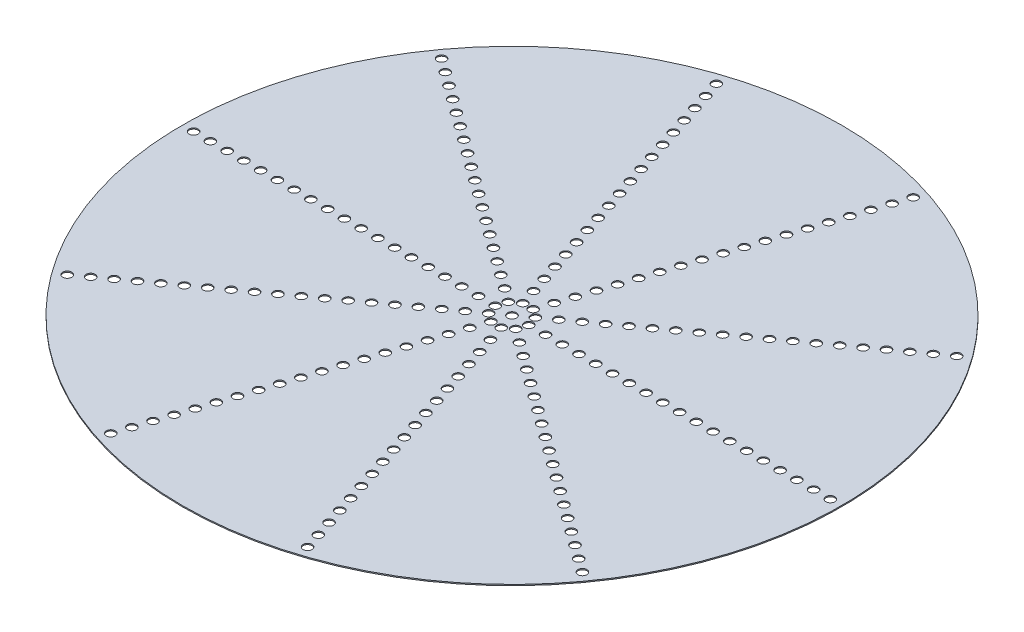
from build123d import *

# Parameters (mm, degrees)
CROQUIS1_R              = 29.5
SALIENTE_EXTRUIR1_DEPTH = 0.1
CROQUIS3_R              = 0.4
CORTAR_EXTRUIR3_DEPTH   = 42.719419938


with BuildPart() as part:
    # Croquis1 → Saliente-Extruir1 (new body)
    with BuildSketch(Plane(origin=(0, 0, 0), x_dir=(1, 0, 0), z_dir=(0, 1, 0))):
        with Locations(Location((0, 0, 0), (0, 0, 270))):
            Circle(CROQUIS1_R)
    extrude(amount=SALIENTE_EXTRUIR1_DEPTH)

    # Croquis3 → Cortar-Extruir3 (cut, through all)
    with BuildSketch(Plane(origin=(0, 0.1, 0), x_dir=(1, 0, 0), z_dir=(0, 1, 0))):
        with Locations(Location((0, 0, 0), (0, 0, 270))):
            Circle(CROQUIS3_R)
        with Locations(Location((1.5, 0, 0), (0, 0, 270))):
            Circle(CROQUIS3_R)
        with Locations(Location((3, 0, 0), (0, 0, 270))):
            Circle(CROQUIS3_R)
        with Locations(Location((4.5, 0, 0), (0, 0, 270))):
            Circle(CROQUIS3_R)
        with Locations(Location((6, 0, 0), (0, 0, 270))):
            Circle(CROQUIS3_R)
        with Locations(Location((7.5, 0, 0), (0, 0, 270))):
            Circle(CROQUIS3_R)
        with Locations(Location((9, 0, 0), (0, 0, 270))):
            Circle(CROQUIS3_R)
        with Locations(Location((10.5, 0, 0), (0, 0, 270))):
            Circle(CROQUIS3_R)
        with Locations(Location((12, 0, 0), (0, 0, 270))):
            Circle(CROQUIS3_R)
        with Locations(Location((13.5, 0, 0), (0, 0, 270))):
            Circle(CROQUIS3_R)
        with Locations(Location((15, 0, 0), (0, 0, 270))):
            Circle(CROQUIS3_R)
        with Locations(Location((16.5, 0, 0), (0, 0, 270))):
            Circle(CROQUIS3_R)
        with Locations(Location((18, 0, 0), (0, 0, 270))):
            Circle(CROQUIS3_R)
        with Locations(Location((19.5, 0, 0), (0, 0, 270))):
            Circle(CROQUIS3_R)
        with Locations(Location((21, 0, 0), (0, 0, 270))):
            Circle(CROQUIS3_R)
        with Locations(Location((22.5, 0, 0), (0, 0, 270))):
            Circle(CROQUIS3_R)
        with Locations(Location((24, 0, 0), (0, 0, 270))):
            Circle(CROQUIS3_R)
        with Locations(Location((25.5, 0, 0), (0, 0, 270))):
            Circle(CROQUIS3_R)
        with Locations(Location((27, 0, 0), (0, 0, 270))):
            Circle(CROQUIS3_R)
        with Locations(Location((28.5, 0, 0), (0, 0, 270))):
            Circle(CROQUIS3_R)
        with Locations(Location((14.562305899, -10.580134541, 0), (0, 0, 270))):
            Circle(CROQUIS3_R)
        with Locations(Location((13.348780407, -9.698456663, 0), (0, 0, 270))):
            Circle(CROQUIS3_R)
        with Locations(Location((12.135254916, -8.816778784, 0), (0, 0, 270))):
            Circle(CROQUIS3_R)
        with Locations(Location((10.921729424, -7.935100906, 0), (0, 0, 270))):
            Circle(CROQUIS3_R)
        with Locations(Location((9.708203932, -7.053423028, 0), (0, 0, 270))):
            Circle(CROQUIS3_R)
        with Locations(Location((8.494678441, -6.171745149, 0), (0, 0, 270))):
            Circle(CROQUIS3_R)
        with Locations(Location((7.281152949, -5.290067271, 0), (0, 0, 270))):
            Circle(CROQUIS3_R)
        with Locations(Location((6.067627458, -4.408389392, 0), (0, 0, 270))):
            Circle(CROQUIS3_R)
        with Locations(Location((4.854101966, -3.526711514, 0), (0, 0, 270))):
            Circle(CROQUIS3_R)
        with Locations(Location((2.427050983, -1.763355757, 0), (0, 0, 270))):
            Circle(CROQUIS3_R)
        with Locations(Location((1.213525492, -0.881677878, 0), (0, 0, 270))):
            Circle(CROQUIS3_R)
        with Locations(Location((3.640576475, -2.645033635, 0), (0, 0, 270))):
            Circle(CROQUIS3_R)
        with Locations(Location((15.77583139, -11.46181242, 0), (0, 0, 270))):
            Circle(CROQUIS3_R)
        with Locations(Location((16.989356882, -12.343490298, 0), (0, 0, 270))):
            Circle(CROQUIS3_R)
        with Locations(Location((18.202882373, -13.225168177, 0), (0, 0, 270))):
            Circle(CROQUIS3_R)
        with Locations(Location((19.416407865, -14.106846055, 0), (0, 0, 270))):
            Circle(CROQUIS3_R)
        with Locations(Location((20.629933357, -14.988523933, 0), (0, 0, 270))):
            Circle(CROQUIS3_R)
        with Locations(Location((21.843458848, -15.870201812, 0), (0, 0, 270))):
            Circle(CROQUIS3_R)
        with Locations(Location((23.05698434, -16.75187969, 0), (0, 0, 270))):
            Circle(CROQUIS3_R)
        with Locations(Location((5.562305899, -17.119017293, 0), (0, 0, 270))):
            Circle(CROQUIS3_R)
        with Locations(Location((5.098780407, -15.692432519, 0), (0, 0, 270))):
            Circle(CROQUIS3_R)
        with Locations(Location((4.635254916, -14.265847744, 0), (0, 0, 270))):
            Circle(CROQUIS3_R)
        with Locations(Location((4.171729424, -12.83926297, 0), (0, 0, 270))):
            Circle(CROQUIS3_R)
        with Locations(Location((3.708203932, -11.412678196, 0), (0, 0, 270))):
            Circle(CROQUIS3_R)
        with Locations(Location((3.244678441, -9.986093421, 0), (0, 0, 270))):
            Circle(CROQUIS3_R)
        with Locations(Location((2.781152949, -8.559508647, 0), (0, 0, 270))):
            Circle(CROQUIS3_R)
        with Locations(Location((2.317627458, -7.132923872, 0), (0, 0, 270))):
            Circle(CROQUIS3_R)
        with Locations(Location((1.854101966, -5.706339098, 0), (0, 0, 270))):
            Circle(CROQUIS3_R)
        with Locations(Location((0.927050983, -2.853169549, 0), (0, 0, 270))):
            Circle(CROQUIS3_R)
        with Locations(Location((0.463525492, -1.426584774, 0), (0, 0, 270))):
            Circle(CROQUIS3_R)
        with Locations(Location((1.390576475, -4.279754323, 0), (0, 0, 270))):
            Circle(CROQUIS3_R)
        with Locations(Location((6.02583139, -18.545602068, 0), (0, 0, 270))):
            Circle(CROQUIS3_R)
        with Locations(Location((6.489356882, -19.972186842, 0), (0, 0, 270))):
            Circle(CROQUIS3_R)
        with Locations(Location((6.952882373, -21.398771617, 0), (0, 0, 270))):
            Circle(CROQUIS3_R)
        with Locations(Location((7.416407865, -22.825356391, 0), (0, 0, 270))):
            Circle(CROQUIS3_R)
        with Locations(Location((7.879933357, -24.251941166, 0), (0, 0, 270))):
            Circle(CROQUIS3_R)
        with Locations(Location((8.343458848, -25.67852594, 0), (0, 0, 270))):
            Circle(CROQUIS3_R)
        with Locations(Location((8.80698434, -27.105110714, 0), (0, 0, 270))):
            Circle(CROQUIS3_R)
        with Locations(Location((-5.562305899, -17.119017293, 0), (0, 0, 270))):
            Circle(CROQUIS3_R)
        with Locations(Location((-5.098780407, -15.692432519, 0), (0, 0, 270))):
            Circle(CROQUIS3_R)
        with Locations(Location((-4.635254916, -14.265847744, 0), (0, 0, 270))):
            Circle(CROQUIS3_R)
        with Locations(Location((-4.171729424, -12.83926297, 0), (0, 0, 270))):
            Circle(CROQUIS3_R)
        with Locations(Location((-3.708203932, -11.412678196, 0), (0, 0, 270))):
            Circle(CROQUIS3_R)
        with Locations(Location((-3.244678441, -9.986093421, 0), (0, 0, 270))):
            Circle(CROQUIS3_R)
        with Locations(Location((-2.781152949, -8.559508647, 0), (0, 0, 270))):
            Circle(CROQUIS3_R)
        with Locations(Location((-2.317627458, -7.132923872, 0), (0, 0, 270))):
            Circle(CROQUIS3_R)
        with Locations(Location((-1.854101966, -5.706339098, 0), (0, 0, 270))):
            Circle(CROQUIS3_R)
        with Locations(Location((-0.927050983, -2.853169549, 0), (0, 0, 270))):
            Circle(CROQUIS3_R)
        with Locations(Location((-0.463525492, -1.426584774, 0), (0, 0, 270))):
            Circle(CROQUIS3_R)
        with Locations(Location((-1.390576475, -4.279754323, 0), (0, 0, 270))):
            Circle(CROQUIS3_R)
        with Locations(Location((-6.02583139, -18.545602068, 0), (0, 0, 270))):
            Circle(CROQUIS3_R)
        with Locations(Location((-6.489356882, -19.972186842, 0), (0, 0, 270))):
            Circle(CROQUIS3_R)
        with Locations(Location((-6.952882373, -21.398771617, 0), (0, 0, 270))):
            Circle(CROQUIS3_R)
        with Locations(Location((-7.416407865, -22.825356391, 0), (0, 0, 270))):
            Circle(CROQUIS3_R)
        with Locations(Location((-7.879933357, -24.251941166, 0), (0, 0, 270))):
            Circle(CROQUIS3_R)
        with Locations(Location((-8.343458848, -25.67852594, 0), (0, 0, 270))):
            Circle(CROQUIS3_R)
        with Locations(Location((-8.80698434, -27.105110714, 0), (0, 0, 270))):
            Circle(CROQUIS3_R)
        with Locations(Location((-14.562305899, -10.580134541, 0), (0, 0, 270))):
            Circle(CROQUIS3_R)
        with Locations(Location((-13.348780407, -9.698456663, 0), (0, 0, 270))):
            Circle(CROQUIS3_R)
        with Locations(Location((-12.135254916, -8.816778784, 0), (0, 0, 270))):
            Circle(CROQUIS3_R)
        with Locations(Location((-10.921729424, -7.935100906, 0), (0, 0, 270))):
            Circle(CROQUIS3_R)
        with Locations(Location((-9.708203932, -7.053423028, 0), (0, 0, 270))):
            Circle(CROQUIS3_R)
        with Locations(Location((-8.494678441, -6.171745149, 0), (0, 0, 270))):
            Circle(CROQUIS3_R)
        with Locations(Location((-7.281152949, -5.290067271, 0), (0, 0, 270))):
            Circle(CROQUIS3_R)
        with Locations(Location((-6.067627458, -4.408389392, 0), (0, 0, 270))):
            Circle(CROQUIS3_R)
        with Locations(Location((-4.854101966, -3.526711514, 0), (0, 0, 270))):
            Circle(CROQUIS3_R)
        with Locations(Location((-2.427050983, -1.763355757, 0), (0, 0, 270))):
            Circle(CROQUIS3_R)
        with Locations(Location((-1.213525492, -0.881677878, 0), (0, 0, 270))):
            Circle(CROQUIS3_R)
        with Locations(Location((-3.640576475, -2.645033635, 0), (0, 0, 270))):
            Circle(CROQUIS3_R)
        with Locations(Location((-15.77583139, -11.46181242, 0), (0, 0, 270))):
            Circle(CROQUIS3_R)
        with Locations(Location((-16.989356882, -12.343490298, 0), (0, 0, 270))):
            Circle(CROQUIS3_R)
        with Locations(Location((-18.202882373, -13.225168177, 0), (0, 0, 270))):
            Circle(CROQUIS3_R)
        with Locations(Location((-19.416407865, -14.106846055, 0), (0, 0, 270))):
            Circle(CROQUIS3_R)
        with Locations(Location((-20.629933357, -14.988523933, 0), (0, 0, 270))):
            Circle(CROQUIS3_R)
        with Locations(Location((-21.843458848, -15.870201812, 0), (0, 0, 270))):
            Circle(CROQUIS3_R)
        with Locations(Location((-23.05698434, -16.75187969, 0), (0, 0, 270))):
            Circle(CROQUIS3_R)
        with Locations(Location((-18, 0, 0), (0, 0, 270))):
            Circle(CROQUIS3_R)
        with Locations(Location((-16.5, 0, 0), (0, 0, 270))):
            Circle(CROQUIS3_R)
        with Locations(Location((-15, 0, 0), (0, 0, 270))):
            Circle(CROQUIS3_R)
        with Locations(Location((-13.5, 0, 0), (0, 0, 270))):
            Circle(CROQUIS3_R)
        with Locations(Location((-12, 0, 0), (0, 0, 270))):
            Circle(CROQUIS3_R)
        with Locations(Location((-10.5, 0, 0), (0, 0, 270))):
            Circle(CROQUIS3_R)
        with Locations(Location((-9, 0, 0), (0, 0, 270))):
            Circle(CROQUIS3_R)
        with Locations(Location((-7.5, 0, 0), (0, 0, 270))):
            Circle(CROQUIS3_R)
        with Locations(Location((-6, 0, 0), (0, 0, 270))):
            Circle(CROQUIS3_R)
        with Locations(Location((-3, 0, 0), (0, 0, 270))):
            Circle(CROQUIS3_R)
        with Locations(Location((-1.5, 0, 0), (0, 0, 270))):
            Circle(CROQUIS3_R)
        with Locations(Location((-4.5, 0, 0), (0, 0, 270))):
            Circle(CROQUIS3_R)
        with Locations(Location((-19.5, 0, 0), (0, 0, 270))):
            Circle(CROQUIS3_R)
        with Locations(Location((-21, 0, 0), (0, 0, 270))):
            Circle(CROQUIS3_R)
        with Locations(Location((-22.5, 0, 0), (0, 0, 270))):
            Circle(CROQUIS3_R)
        with Locations(Location((-24, 0, 0), (0, 0, 270))):
            Circle(CROQUIS3_R)
        with Locations(Location((-25.5, 0, 0), (0, 0, 270))):
            Circle(CROQUIS3_R)
        with Locations(Location((-27, 0, 0), (0, 0, 270))):
            Circle(CROQUIS3_R)
        with Locations(Location((-28.5, 0, 0), (0, 0, 270))):
            Circle(CROQUIS3_R)
        with Locations(Location((-14.562305899, 10.580134541, 0), (0, 0, 270))):
            Circle(CROQUIS3_R)
        with Locations(Location((-13.348780407, 9.698456663, 0), (0, 0, 270))):
            Circle(CROQUIS3_R)
        with Locations(Location((-12.135254916, 8.816778784, 0), (0, 0, 270))):
            Circle(CROQUIS3_R)
        with Locations(Location((-10.921729424, 7.935100906, 0), (0, 0, 270))):
            Circle(CROQUIS3_R)
        with Locations(Location((-9.708203932, 7.053423028, 0), (0, 0, 270))):
            Circle(CROQUIS3_R)
        with Locations(Location((-8.494678441, 6.171745149, 0), (0, 0, 270))):
            Circle(CROQUIS3_R)
        with Locations(Location((-7.281152949, 5.290067271, 0), (0, 0, 270))):
            Circle(CROQUIS3_R)
        with Locations(Location((-6.067627458, 4.408389392, 0), (0, 0, 270))):
            Circle(CROQUIS3_R)
        with Locations(Location((-4.854101966, 3.526711514, 0), (0, 0, 270))):
            Circle(CROQUIS3_R)
        with Locations(Location((-2.427050983, 1.763355757, 0), (0, 0, 270))):
            Circle(CROQUIS3_R)
        with Locations(Location((-1.213525492, 0.881677878, 0), (0, 0, 270))):
            Circle(CROQUIS3_R)
        with Locations(Location((-3.640576475, 2.645033635, 0), (0, 0, 270))):
            Circle(CROQUIS3_R)
        with Locations(Location((-15.77583139, 11.46181242, 0), (0, 0, 270))):
            Circle(CROQUIS3_R)
        with Locations(Location((-16.989356882, 12.343490298, 0), (0, 0, 270))):
            Circle(CROQUIS3_R)
        with Locations(Location((-18.202882373, 13.225168177, 0), (0, 0, 270))):
            Circle(CROQUIS3_R)
        with Locations(Location((-19.416407865, 14.106846055, 0), (0, 0, 270))):
            Circle(CROQUIS3_R)
        with Locations(Location((-20.629933357, 14.988523933, 0), (0, 0, 270))):
            Circle(CROQUIS3_R)
        with Locations(Location((-21.843458848, 15.870201812, 0), (0, 0, 270))):
            Circle(CROQUIS3_R)
        with Locations(Location((-23.05698434, 16.75187969, 0), (0, 0, 270))):
            Circle(CROQUIS3_R)
        with Locations(Location((-5.562305899, 17.119017293, 0), (0, 0, 270))):
            Circle(CROQUIS3_R)
        with Locations(Location((-5.098780407, 15.692432519, 0), (0, 0, 270))):
            Circle(CROQUIS3_R)
        with Locations(Location((-4.635254916, 14.265847744, 0), (0, 0, 270))):
            Circle(CROQUIS3_R)
        with Locations(Location((-4.171729424, 12.83926297, 0), (0, 0, 270))):
            Circle(CROQUIS3_R)
        with Locations(Location((-3.708203932, 11.412678196, 0), (0, 0, 270))):
            Circle(CROQUIS3_R)
        with Locations(Location((-3.244678441, 9.986093421, 0), (0, 0, 270))):
            Circle(CROQUIS3_R)
        with Locations(Location((-2.781152949, 8.559508647, 0), (0, 0, 270))):
            Circle(CROQUIS3_R)
        with Locations(Location((-2.317627458, 7.132923872, 0), (0, 0, 270))):
            Circle(CROQUIS3_R)
        with Locations(Location((-1.854101966, 5.706339098, 0), (0, 0, 270))):
            Circle(CROQUIS3_R)
        with Locations(Location((-0.927050983, 2.853169549, 0), (0, 0, 270))):
            Circle(CROQUIS3_R)
        with Locations(Location((-0.463525492, 1.426584774, 0), (0, 0, 270))):
            Circle(CROQUIS3_R)
        with Locations(Location((-1.390576475, 4.279754323, 0), (0, 0, 270))):
            Circle(CROQUIS3_R)
        with Locations(Location((-6.02583139, 18.545602068, 0), (0, 0, 270))):
            Circle(CROQUIS3_R)
        with Locations(Location((-6.489356882, 19.972186842, 0), (0, 0, 270))):
            Circle(CROQUIS3_R)
        with Locations(Location((-6.952882373, 21.398771617, 0), (0, 0, 270))):
            Circle(CROQUIS3_R)
        with Locations(Location((-7.416407865, 22.825356391, 0), (0, 0, 270))):
            Circle(CROQUIS3_R)
        with Locations(Location((-7.879933357, 24.251941166, 0), (0, 0, 270))):
            Circle(CROQUIS3_R)
        with Locations(Location((-8.343458848, 25.67852594, 0), (0, 0, 270))):
            Circle(CROQUIS3_R)
        with Locations(Location((-8.80698434, 27.105110714, 0), (0, 0, 270))):
            Circle(CROQUIS3_R)
        with Locations(Location((5.562305899, 17.119017293, 0), (0, 0, 270))):
            Circle(CROQUIS3_R)
        with Locations(Location((5.098780407, 15.692432519, 0), (0, 0, 270))):
            Circle(CROQUIS3_R)
        with Locations(Location((4.635254916, 14.265847744, 0), (0, 0, 270))):
            Circle(CROQUIS3_R)
        with Locations(Location((4.171729424, 12.83926297, 0), (0, 0, 270))):
            Circle(CROQUIS3_R)
        with Locations(Location((3.708203932, 11.412678196, 0), (0, 0, 270))):
            Circle(CROQUIS3_R)
        with Locations(Location((3.244678441, 9.986093421, 0), (0, 0, 270))):
            Circle(CROQUIS3_R)
        with Locations(Location((2.781152949, 8.559508647, 0), (0, 0, 270))):
            Circle(CROQUIS3_R)
        with Locations(Location((2.317627458, 7.132923872, 0), (0, 0, 270))):
            Circle(CROQUIS3_R)
        with Locations(Location((1.854101966, 5.706339098, 0), (0, 0, 270))):
            Circle(CROQUIS3_R)
        with Locations(Location((0.927050983, 2.853169549, 0), (0, 0, 270))):
            Circle(CROQUIS3_R)
        with Locations(Location((0.463525492, 1.426584774, 0), (0, 0, 270))):
            Circle(CROQUIS3_R)
        with Locations(Location((1.390576475, 4.279754323, 0), (0, 0, 270))):
            Circle(CROQUIS3_R)
        with Locations(Location((6.02583139, 18.545602068, 0), (0, 0, 270))):
            Circle(CROQUIS3_R)
        with Locations(Location((6.489356882, 19.972186842, 0), (0, 0, 270))):
            Circle(CROQUIS3_R)
        with Locations(Location((6.952882373, 21.398771617, 0), (0, 0, 270))):
            Circle(CROQUIS3_R)
        with Locations(Location((7.416407865, 22.825356391, 0), (0, 0, 270))):
            Circle(CROQUIS3_R)
        with Locations(Location((7.879933357, 24.251941166, 0), (0, 0, 270))):
            Circle(CROQUIS3_R)
        with Locations(Location((8.343458848, 25.67852594, 0), (0, 0, 270))):
            Circle(CROQUIS3_R)
        with Locations(Location((8.80698434, 27.105110714, 0), (0, 0, 270))):
            Circle(CROQUIS3_R)
        with Locations(Location((14.562305899, 10.580134541, 0), (0, 0, 270))):
            Circle(CROQUIS3_R)
        with Locations(Location((13.348780407, 9.698456663, 0), (0, 0, 270))):
            Circle(CROQUIS3_R)
        with Locations(Location((12.135254916, 8.816778784, 0), (0, 0, 270))):
            Circle(CROQUIS3_R)
        with Locations(Location((10.921729424, 7.935100906, 0), (0, 0, 270))):
            Circle(CROQUIS3_R)
        with Locations(Location((9.708203932, 7.053423028, 0), (0, 0, 270))):
            Circle(CROQUIS3_R)
        with Locations(Location((8.494678441, 6.171745149, 0), (0, 0, 270))):
            Circle(CROQUIS3_R)
        with Locations(Location((7.281152949, 5.290067271, 0), (0, 0, 270))):
            Circle(CROQUIS3_R)
        with Locations(Location((6.067627458, 4.408389392, 0), (0, 0, 270))):
            Circle(CROQUIS3_R)
        with Locations(Location((4.854101966, 3.526711514, 0), (0, 0, 270))):
            Circle(CROQUIS3_R)
        with Locations(Location((2.427050983, 1.763355757, 0), (0, 0, 270))):
            Circle(CROQUIS3_R)
        with Locations(Location((1.213525492, 0.881677878, 0), (0, 0, 270))):
            Circle(CROQUIS3_R)
        with Locations(Location((3.640576475, 2.645033635, 0), (0, 0, 270))):
            Circle(CROQUIS3_R)
        with Locations(Location((15.77583139, 11.46181242, 0), (0, 0, 270))):
            Circle(CROQUIS3_R)
        with Locations(Location((16.989356882, 12.343490298, 0), (0, 0, 270))):
            Circle(CROQUIS3_R)
        with Locations(Location((18.202882373, 13.225168177, 0), (0, 0, 270))):
            Circle(CROQUIS3_R)
        with Locations(Location((19.416407865, 14.106846055, 0), (0, 0, 270))):
            Circle(CROQUIS3_R)
        with Locations(Location((20.629933357, 14.988523933, 0), (0, 0, 270))):
            Circle(CROQUIS3_R)
        with Locations(Location((21.843458848, 15.870201812, 0), (0, 0, 270))):
            Circle(CROQUIS3_R)
        with Locations(Location((23.05698434, 16.75187969, 0), (0, 0, 270))):
            Circle(CROQUIS3_R)
    extrude(amount=-CORTAR_EXTRUIR3_DEPTH, mode=Mode.SUBTRACT)


solid = part.part
